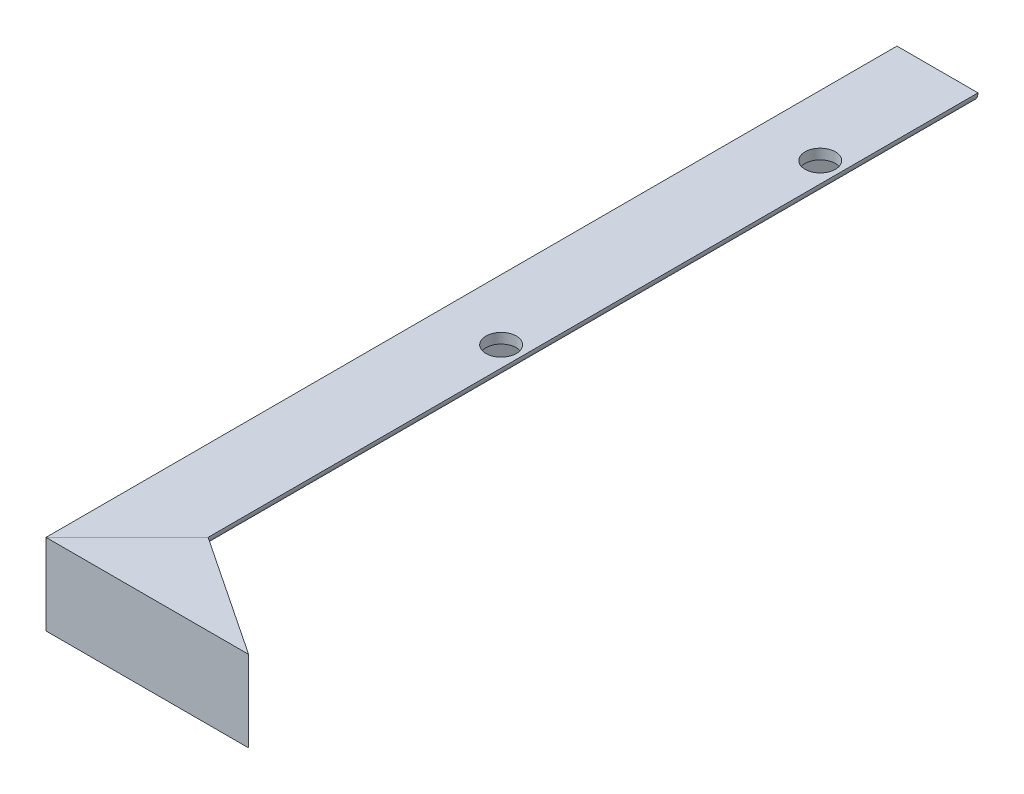
from build123d import *

# Parameters (mm, degrees)
HIERRO_ANGULAR_2_X_2_X_0_125_1_DEPTH        = 606.242048969
HIERRO_ANGULAR_2_X_2_X_0_125_1_2_DEPTH      = 127
HIERRO_ANGULAR_2_X_2_X_0_125_1_2_DEPTH_BACK = 72.842048969
CROQUIS2_R                                  = 9.525
CORTAR_EXTRUIR1_DEPTH                       = 551.658878072
CORTAR_EXTRUIR2_DEPTH                       = 176.53


with BuildPart() as part:
    # Sketch1 on segment 1 (carried to segment 1) → Hierro angular 2 X 2 X 0.125(1) (new body)
    with BuildSketch(Plane(origin=(0, 0, -533.4), x_dir=(0, -1, 0), z_dir=(0, 0, 1))):
        with BuildLine():
            Line((0, 0), (0, 50.8))
            Line((0, 50.8), (0.00508, 50.8))
            ThreePointArc((0.00508, 50.8), (4.491615958, 48.941615958), (6.35, 44.45508))
            Line((6.35, 44.45508), (6.35, 11.1125))
            ThreePointArc((6.35, 11.1125), (7.744903955, 7.744903955), (11.1125, 6.35))
            Line((11.1125, 6.35), (44.45508, 6.35))
            ThreePointArc((44.45508, 6.35), (48.941615958, 4.491615958), (50.8, 0.00508))
            Line((50.8, 0.00508), (50.8, 0))
            Line((50.8, 0), (0, 0))
        make_face()
    extrude(amount=HIERRO_ANGULAR_2_X_2_X_0_125_1_DEPTH)

    # Hierro angular 2 X 2 X 0.125(1) mitre 1
    split(bisect_by=Plane(origin=(0, 0, 0), x_dir=(0, -1, 0), z_dir=(-0.707106781, 0, -0.707106781)), keep=Keep.TOP)

    # Croquis2 → Cortar-Extruir1 (cut, through all)
    with BuildSketch(Plane(origin=(0, 0, 0), x_dir=(1, 0, 0), z_dir=(0, 1, 0))):
        with Locations(Location((38.1, 447.2, 0), (0, 0, 180))):
            Circle(CROQUIS2_R)
        with Locations(Location((38.1, 247.2, 0), (0, 0, 180))):
            Circle(CROQUIS2_R)
    extrude(amount=-CORTAR_EXTRUIR1_DEPTH, mode=Mode.SUBTRACT)


with BuildPart() as body_2:
    # Sketch1 → Hierro angular 2 X 2 X 0.125_1 2 (new, two sides: drawn at the far end of the back side and taken through both)
    with BuildSketch(Plane(origin=(0, 0, 0), x_dir=(0, -1, 0), z_dir=(1, 0, 0)).offset(-HIERRO_ANGULAR_2_X_2_X_0_125_1_2_DEPTH_BACK)):
        with BuildLine():
            Line((0, 0), (0, 50.8))
            Line((0, 50.8), (0.00508, 50.8))
            ThreePointArc((0.00508, 50.8), (4.491615958, 48.941615958), (6.35, 44.45508))
            Line((6.35, 44.45508), (6.35, 11.1125))
            ThreePointArc((6.35, 11.1125), (7.744903955, 7.744903955), (11.1125, 6.35))
            Line((11.1125, 6.35), (44.45508, 6.35))
            ThreePointArc((44.45508, 6.35), (48.941615958, 4.491615958), (50.8, 0.00508))
            Line((50.8, 0.00508), (50.8, 0))
            Line((50.8, 0), (0, 0))
        make_face()
    extrude(amount=HIERRO_ANGULAR_2_X_2_X_0_125_1_2_DEPTH + HIERRO_ANGULAR_2_X_2_X_0_125_1_2_DEPTH_BACK)

    # Hierro angular 2 X 2 X 0.125_1 2 mitre 1
    split(bisect_by=Plane(origin=(0, 0, 0), x_dir=(0, 1, 0), z_dir=(0.707106781, 0, 0.707106781)), keep=Keep.TOP)

    # Croquis3 → Cortar-Extruir2 (cut)
    with BuildSketch(Plane(origin=(0, 0, 0), x_dir=(1, 0, 0), z_dir=(0, 1, 0))):
        Polygon((127, 0), (50.8, 50.8), (127, 50.8), align=None)
    extrude(amount=-CORTAR_EXTRUIR2_DEPTH, mode=Mode.SUBTRACT)


solid = Compound([part.part, body_2.part])
